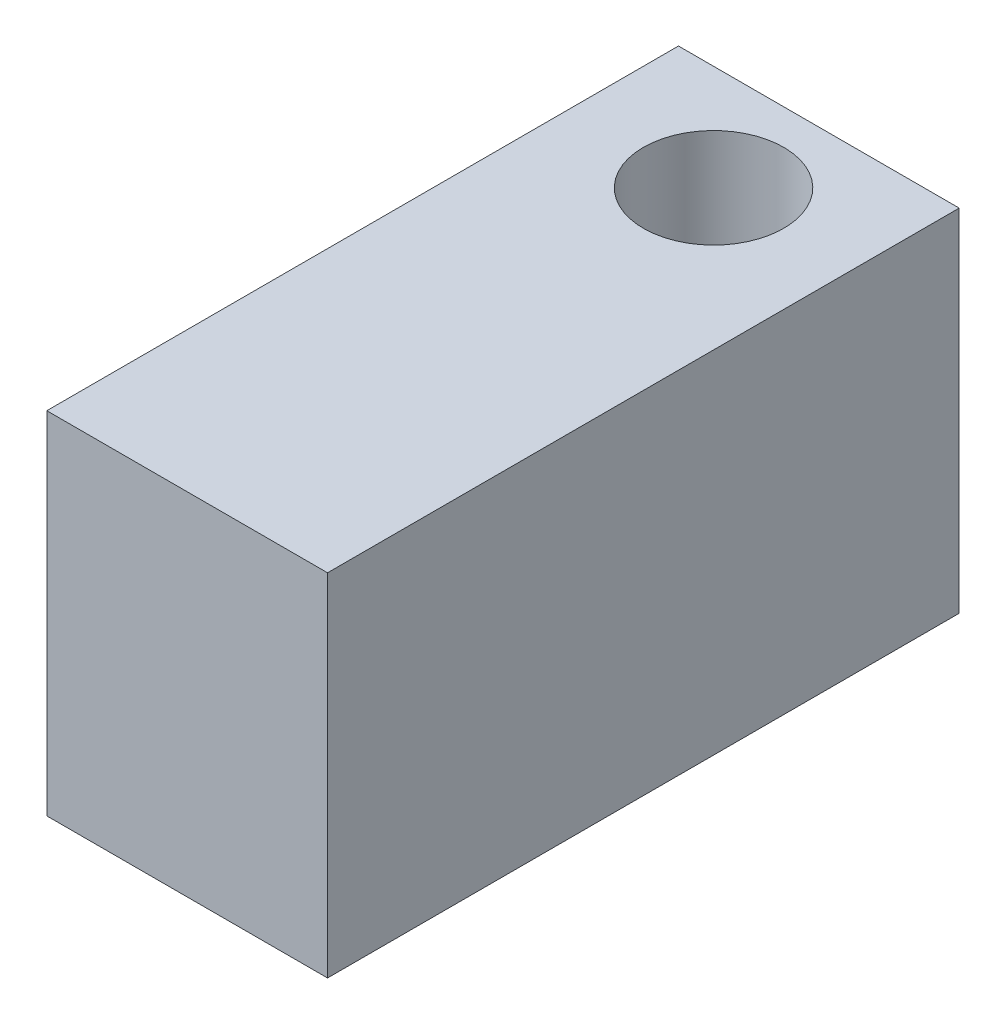
from build123d import *

# Parameters (mm, degrees)
SKETCH1_W           = 40
SKETCH1_H           = 50
BOSS_EXTRUDE1_DEPTH = 90
CUT_EXTRUDE1_REACH  = 106.881
SKETCH2_R           = 10


with BuildPart() as part:
    # Sketch1 → Boss-Extrude1 (new body)
    with BuildSketch(Plane.XY):
        Rectangle(SKETCH1_W, SKETCH1_H)
    extrude(amount=BOSS_EXTRUDE1_DEPTH)

    # Sketch2 → Cut-Extrude1 (cut, up to next)
    with BuildSketch(Plane(origin=(0, 25, 0), x_dir=(1, 0, 0), z_dir=(0, 1, 0)), mode=Mode.PRIVATE) as cut_extrude1_sk1:
        with Locations(Location((0, -15, 0), (0, 0, 180))):
            Circle(SKETCH2_R)
    cut_extrude1_tool1 = extrude(cut_extrude1_sk1.sketch, amount=-CUT_EXTRUDE1_REACH, mode=Mode.PRIVATE) & part.part
    add(cut_extrude1_tool1.solids().sort_by_distance((0, 25, 15))[0], mode=Mode.SUBTRACT)


solid = part.part
